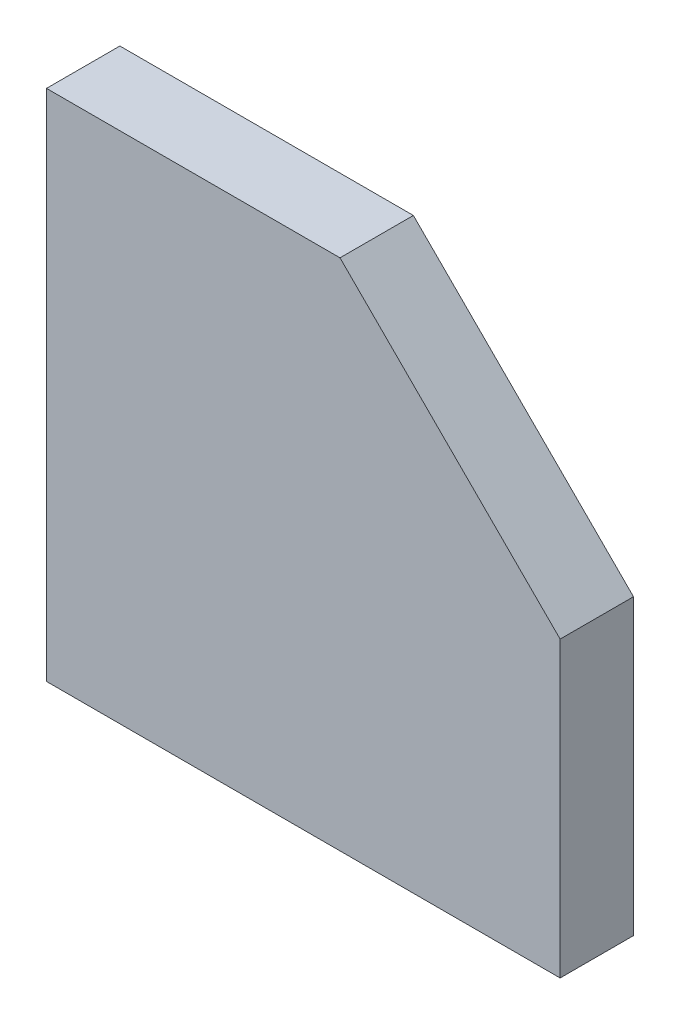
from build123d import *

# Parameters (mm, degrees)
EXTRUDE_1_DEPTH = 10


with BuildPart() as part:
    # Эскиз1 → Бобышка-Вытянуть1 (new body)
    with BuildSketch(Plane.XY):
        Polygon((40, 70), (70, 40), (70, 0), (0, 0), (0, 70), align=None)
    extrude(amount=EXTRUDE_1_DEPTH)


solid = part.part
